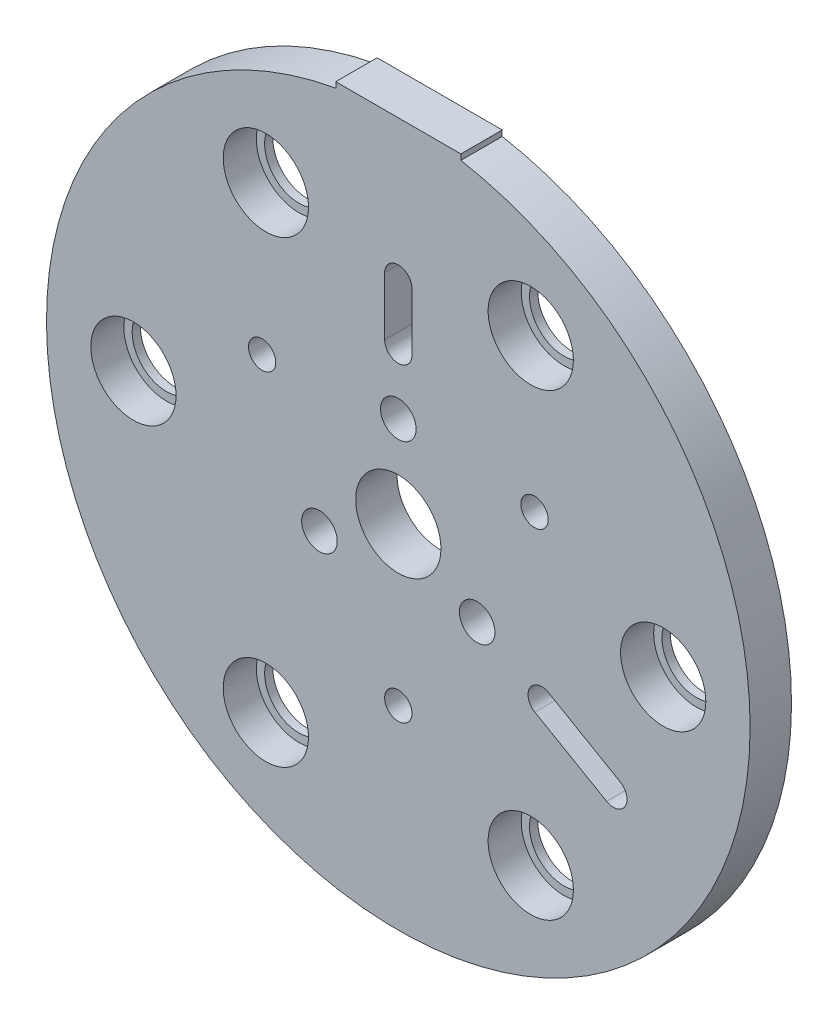
from build123d import *

# Parameters (mm, degrees)
SKETCH_1_R          = 42.5
EXTRUDE_1_DEPTH     = 5
SKETCH_2_R          = 5.15
CUT_EXTRUDE_1_DEPTH = 61.311690409
SKETCH_3_R          = 5.15
CUT_EXTRUDE_2_DEPTH = 61.311690409
EXTRUDE_START       = -1
SKETCH_4_R          = 5.15
SKETCH_4_R_2        = 4.15
EXTRUDE_1_2_DEPTH   = 1
CUT_EXTRUDE_3_REACH = 62.312
SKETCH_5_R          = 1.65
CUT_EXTRUDE_4_REACH = 62.312
CUT_EXTRUDE_6_REACH = 62.312
SKETCH_10_R         = 2.15
CUT_EXTRUDE_7_REACH = 62.312
SKETCH_17_W         = 15.112394154
SKETCH_17_H         = 1
EXTRUDE_6_DEPTH     = 5


with BuildPart() as part:
    # 草图1 → Extrude 1 (new body)
    with BuildSketch(Plane.XY):
        Circle(SKETCH_1_R)
    extrude(amount=-EXTRUDE_1_DEPTH)

    # 草图2 → 切除-拉伸1 (cut, through all)
    with BuildSketch(Plane.XY):
        with Locations((-32, 0)):
            Circle(SKETCH_2_R)
        with Locations((-16, 27.712812921)):
            Circle(SKETCH_2_R)
        with Locations((16, 27.712812921)):
            Circle(SKETCH_2_R)
        with Locations((32, 0)):
            Circle(SKETCH_2_R)
        with Locations((16, -27.712812921)):
            Circle(SKETCH_2_R)
        with Locations((-16, -27.712812921)):
            Circle(SKETCH_2_R)
    extrude(amount=-CUT_EXTRUDE_1_DEPTH, mode=Mode.SUBTRACT)

    # 草图3 → 切除-拉伸2 (cut, through all)
    with BuildSketch(Plane.XY):
        Circle(SKETCH_3_R)
    extrude(amount=-CUT_EXTRUDE_2_DEPTH, mode=Mode.SUBTRACT)

    # 草图4 → Extrude 1 2 (add)
    # profile 1 of 6: a face of its own
    with BuildSketch(Plane(origin=(0, 0, -5), x_dir=(-1, 0, 0), z_dir=(0, 0, -1)).offset(EXTRUDE_START)):
        with Locations((-16, 27.712812921)):
            Circle(SKETCH_4_R)
        with Locations((-16, 27.712812921)):
            Circle(SKETCH_4_R_2, mode=Mode.SUBTRACT)
    # profile 2 of 6: a face of its own
    with BuildSketch(Plane(origin=(0, 0, -5), x_dir=(-1, 0, 0), z_dir=(0, 0, -1)).offset(EXTRUDE_START)):
        with Locations((16, 27.712812921)):
            Circle(SKETCH_4_R)
        with Locations((16, 27.712812921)):
            Circle(SKETCH_4_R_2, mode=Mode.SUBTRACT)
    # profile 3 of 6: a face of its own
    with BuildSketch(Plane(origin=(0, 0, -5), x_dir=(-1, 0, 0), z_dir=(0, 0, -1)).offset(EXTRUDE_START)):
        with Locations((32, 0)):
            Circle(SKETCH_4_R)
        with Locations((32, 0)):
            Circle(SKETCH_4_R_2, mode=Mode.SUBTRACT)
    # profile 4 of 6: a face of its own
    with BuildSketch(Plane(origin=(0, 0, -5), x_dir=(-1, 0, 0), z_dir=(0, 0, -1)).offset(EXTRUDE_START)):
        with Locations((16, -27.712812921)):
            Circle(SKETCH_4_R)
        with Locations((16, -27.712812921)):
            Circle(SKETCH_4_R_2, mode=Mode.SUBTRACT)
    # profile 5 of 6: a face of its own
    with BuildSketch(Plane(origin=(0, 0, -5), x_dir=(-1, 0, 0), z_dir=(0, 0, -1)).offset(EXTRUDE_START)):
        with Locations((-16, -27.712812921)):
            Circle(SKETCH_4_R)
        with Locations((-16, -27.712812921)):
            Circle(SKETCH_4_R_2, mode=Mode.SUBTRACT)
    # profile 6 of 6: a face of its own
    with BuildSketch(Plane(origin=(0, 0, -5), x_dir=(-1, 0, 0), z_dir=(0, 0, -1)).offset(EXTRUDE_START)):
        with Locations((-32, 0)):
            Circle(SKETCH_4_R)
        with Locations((-32, 0)):
            Circle(SKETCH_4_R_2, mode=Mode.SUBTRACT)
    extrude(amount=EXTRUDE_1_2_DEPTH)

    # 草图5 → 切除-拉伸3 (cut, up to next)
    with BuildSketch(Plane(origin=(0, 0, -5), x_dir=(-1, 0, 0), z_dir=(0, 0, -1)), mode=Mode.PRIVATE) as cut_extrude_3_sk1:
        with Locations((-16.454482672, 9.5)):
            Circle(SKETCH_5_R)
    cut_extrude_3_tool1 = extrude(cut_extrude_3_sk1.sketch, amount=-CUT_EXTRUDE_3_REACH, mode=Mode.PRIVATE) & part.part
    # 草图5 → 切除-拉伸3 (cut, up to next)
    with BuildSketch(Plane(origin=(0, 0, -5), x_dir=(-1, 0, 0), z_dir=(0, 0, -1)), mode=Mode.PRIVATE) as cut_extrude_3_sk2:
        with Locations((16.454482672, 9.5)):
            Circle(SKETCH_5_R)
    cut_extrude_3_tool2 = extrude(cut_extrude_3_sk2.sketch, amount=-CUT_EXTRUDE_3_REACH, mode=Mode.PRIVATE) & part.part
    # 草图5 → 切除-拉伸3 (cut, up to next)
    with BuildSketch(Plane(origin=(0, 0, -5), x_dir=(-1, 0, 0), z_dir=(0, 0, -1)), mode=Mode.PRIVATE) as cut_extrude_3_sk3:
        with Locations((0, -19)):
            Circle(SKETCH_5_R)
    cut_extrude_3_tool3 = extrude(cut_extrude_3_sk3.sketch, amount=-CUT_EXTRUDE_3_REACH, mode=Mode.PRIVATE) & part.part
    add(cut_extrude_3_tool1.solids().sort_by_distance((16.454483, 9.5, -5))[0], mode=Mode.SUBTRACT)
    add(cut_extrude_3_tool2.solids().sort_by_distance((-16.454483, 9.5, -5))[0], mode=Mode.SUBTRACT)
    add(cut_extrude_3_tool3.solids().sort_by_distance((0, -19, -5))[0], mode=Mode.SUBTRACT)

    # 草图7 → 切除-拉伸4 (cut, up to next)
    with BuildSketch(Plane(origin=(0, 0, -5), x_dir=(-1, 0, 0), z_dir=(0, 0, -1)), mode=Mode.PRIVATE) as cut_extrude_4_sk1:
        with BuildLine():
            Line((-16.495508076, -11.428941916), (-25.155762114, -16.428941916))
            ThreePointArc((-25.155762114, -16.428941916), (-27.40970403, -15.825), (-26.805762114, -13.571058084))
            Line((-26.805762114, -13.571058084), (-18.145508076, -8.571058084))
            ThreePointArc((-18.145508076, -8.571058084), (-15.891566159, -9.175), (-16.495508076, -11.428941916))
        make_face()
    cut_extrude_4_tool1 = extrude(cut_extrude_4_sk1.sketch, amount=-CUT_EXTRUDE_4_REACH, mode=Mode.PRIVATE) & part.part
    add(cut_extrude_4_tool1.solids().sort_by_distance((21.650635, -12.5, -5))[0], mode=Mode.SUBTRACT)

    # 草图10 → 切除-拉伸6 (cut, up to next)
    with BuildSketch(Plane(origin=(0, 0, -5), x_dir=(-1, 0, 0), z_dir=(0, 0, -1)), mode=Mode.PRIVATE) as cut_extrude_6_sk1:
        with Locations((-9.526279442, -5.5)):
            Circle(SKETCH_10_R)
    cut_extrude_6_tool1 = extrude(cut_extrude_6_sk1.sketch, amount=-CUT_EXTRUDE_6_REACH, mode=Mode.PRIVATE) & part.part
    # 草图10 → 切除-拉伸6 (cut, up to next)
    with BuildSketch(Plane(origin=(0, 0, -5), x_dir=(-1, 0, 0), z_dir=(0, 0, -1)), mode=Mode.PRIVATE) as cut_extrude_6_sk2:
        with Locations((0, 11)):
            Circle(SKETCH_10_R)
    cut_extrude_6_tool2 = extrude(cut_extrude_6_sk2.sketch, amount=-CUT_EXTRUDE_6_REACH, mode=Mode.PRIVATE) & part.part
    # 草图10 → 切除-拉伸6 (cut, up to next)
    with BuildSketch(Plane(origin=(0, 0, -5), x_dir=(-1, 0, 0), z_dir=(0, 0, -1)), mode=Mode.PRIVATE) as cut_extrude_6_sk3:
        with Locations((9.526279442, -5.5)):
            Circle(SKETCH_10_R)
    cut_extrude_6_tool3 = extrude(cut_extrude_6_sk3.sketch, amount=-CUT_EXTRUDE_6_REACH, mode=Mode.PRIVATE) & part.part
    add(cut_extrude_6_tool1.solids().sort_by_distance((9.526279, -5.5, -5))[0], mode=Mode.SUBTRACT)
    add(cut_extrude_6_tool2.solids().sort_by_distance((0, 11, -5))[0], mode=Mode.SUBTRACT)
    add(cut_extrude_6_tool3.solids().sort_by_distance((-9.526279, -5.5, -5))[0], mode=Mode.SUBTRACT)

    # 草图11 → 切除-拉伸7 (cut, up to next)
    with BuildSketch(Plane.XY, mode=Mode.PRIVATE) as cut_extrude_7_sk1:
        with BuildLine():
            Line((1.65, 25.457782029), (1.65, 18.457782029))
            ThreePointArc((1.65, 18.457782029), (0, 16.807782029), (-1.65, 18.457782029))
            Line((-1.65, 18.457782029), (-1.65, 25.457782029))
            ThreePointArc((-1.65, 25.457782029), (0, 27.107782029), (1.65, 25.457782029))
        make_face()
    cut_extrude_7_tool1 = extrude(cut_extrude_7_sk1.sketch, amount=-CUT_EXTRUDE_7_REACH, mode=Mode.PRIVATE) & part.part
    add(cut_extrude_7_tool1.solids().sort_by_distance((0, 21.957782, 0))[0], mode=Mode.SUBTRACT)

    # 草图17 → 拉伸-薄壁6 (add)
    with BuildSketch(Plane(origin=(0, 0, -5), x_dir=(-1, 0, 0), z_dir=(0, 0, -1))):
        with Locations((0, 42)):
            Rectangle(SKETCH_17_W, SKETCH_17_H)
    extrude(amount=-EXTRUDE_6_DEPTH)


solid = part.part
